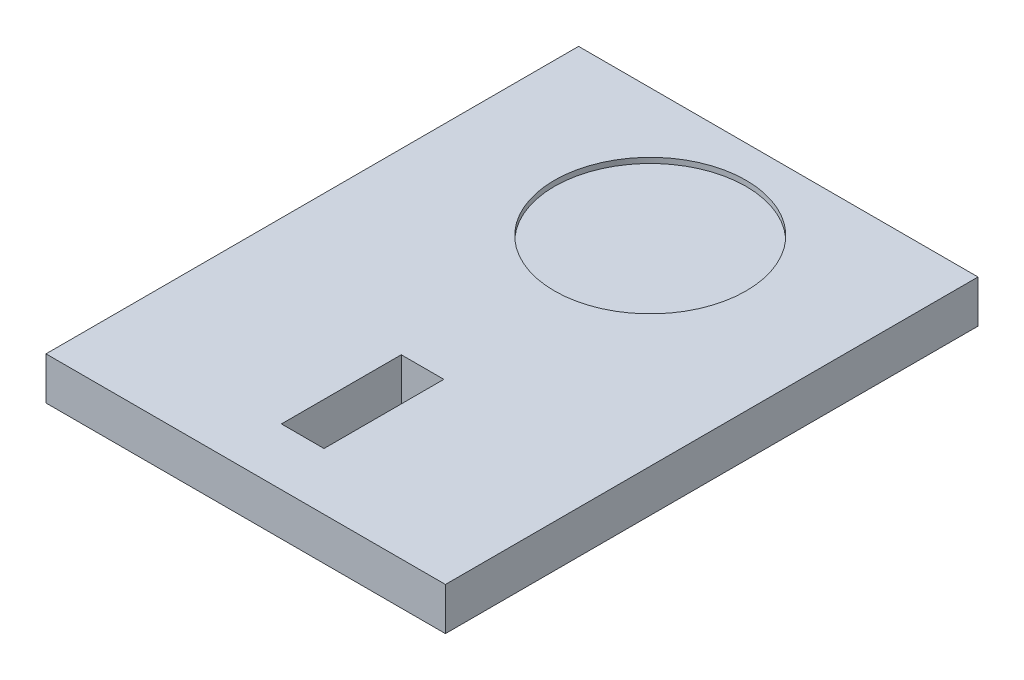
from build123d import *

# Parameters (mm, degrees)
IZIM1_W                     = 150
IZIM1_H                     = 200
Y_KSEKLIK_EKSTR_ZYON1_DEPTH = 16
IZIM2_W                     = 16
IZIM2_H                     = 45
KES_EKSTR_ZYON1_DEPTH       = 29
IZIM3_R                     = 36
KES_EKSTR_ZYON3_DEPTH       = 2


with BuildPart() as part:
    # Çizim1 → Yükseklik-Ekstrüzyon1 (new body)
    with BuildSketch(Plane(origin=(0, 0, 0), x_dir=(1, 0, 0), z_dir=(0, 1, 0))):
        with Locations((-57.984293194, 82.460732984)):
            Rectangle(IZIM1_W, IZIM1_H)
    extrude(amount=Y_KSEKLIK_EKSTR_ZYON1_DEPTH)

    # Çizim2 → Kes-Ekstrüzyon1 (cut)
    with BuildSketch(Plane(origin=(0, 16, 0), x_dir=(1, 0, 0), z_dir=(0, 1, 0))):
        with Locations((-57.984293194, 26.373411694)):
            Rectangle(IZIM2_W, IZIM2_H)
    extrude(amount=-KES_EKSTR_ZYON1_DEPTH, mode=Mode.SUBTRACT)

    # Çizim3 → Kes-Ekstrüzyon3 (cut)
    with BuildSketch(Plane(origin=(0, 16, 0), x_dir=(1, 0, 0), z_dir=(0, 1, 0))):
        with Locations(Location((-57.984293194, 134.377130507, 0), (0, 0, 270))):
            Circle(IZIM3_R)
    extrude(amount=-KES_EKSTR_ZYON3_DEPTH, mode=Mode.SUBTRACT)


solid = part.part
